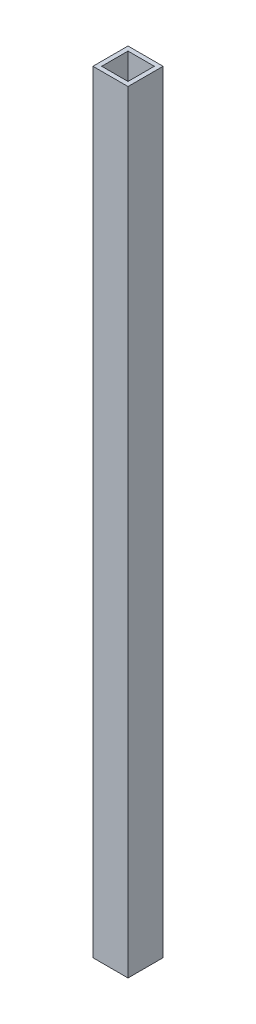
from build123d import *

# Parameters (mm, degrees)
SKETCH1_W           = 25.4
SKETCH1_H           = 25.4
SKETCH1_W_2         = 19.05
SKETCH1_H_2         = 19.05
BOSS_EXTRUDE1_DEPTH = 558.8


with BuildPart() as part:
    # Sketch1 → Boss-Extrude1 (new body)
    with BuildSketch(Plane(origin=(0, 0, 0), x_dir=(1, 0, 0), z_dir=(0, 1, 0))):
        Rectangle(SKETCH1_W, SKETCH1_H)
        Rectangle(SKETCH1_W_2, SKETCH1_H_2, mode=Mode.SUBTRACT)
    extrude(amount=BOSS_EXTRUDE1_DEPTH)


solid = part.part
